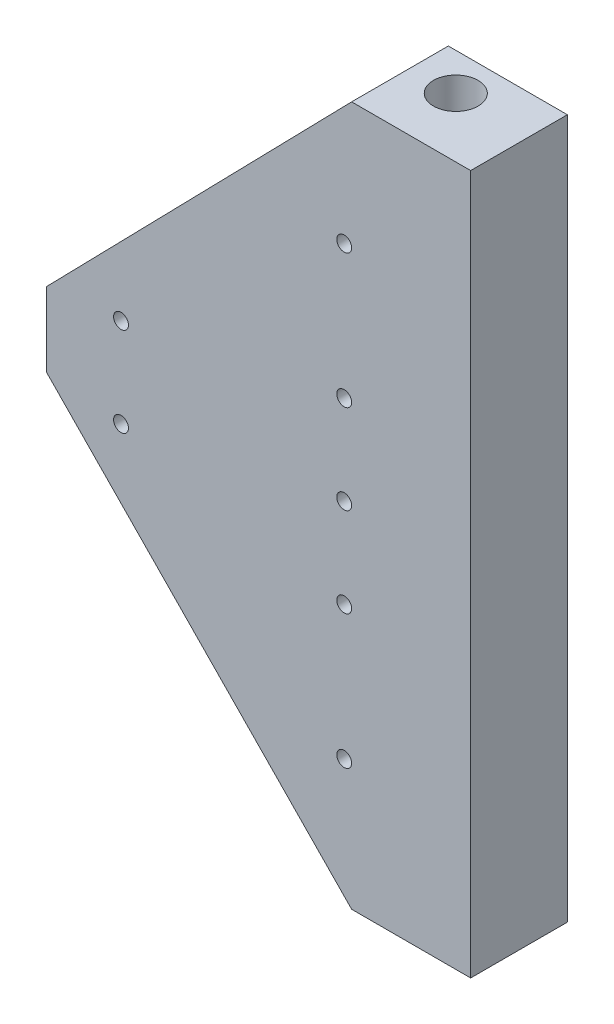
from build123d import *

# Parameters (mm, degrees)
SKETCH2_W               = 80
SKETCH2_H               = 25
BOSS_EXTRUDE1_DEPTH     = 65
BOSS_EXTRUDE1_2_DEPTH   = 65
SKETCH2_W_2             = 70
SKETCH2_H_2             = 10
BOSS_EXTRUDE1_3_DEPTH   = 65
BOSS_EXTRUDE1_4_DEPTH   = 65
SKETCH2_H_3             = 30
BOSS_EXTRUDE1_5_DEPTH   = 65
BOSS_EXTRUDE1_6_DEPTH   = 65
CUT_EXTRUDE1_DEPTH      = 313.209865315
CUT_EXTRUDE1_DEPTH_BACK = 313.209865315
SKETCH3_R               = 15
SKETCH3_R_2             = 6.25
BOSS_EXTRUDE5_DEPTH     = 10
CUT_EXTRUDE2_REACH      = 314.21
SKETCH7_R               = 5
SKETCH8_W               = 65
SKETCH8_H               = 470
BOSS_EXTRUDE6_DEPTH     = 3


with BuildPart() as part:
    # Sketch2 → Boss-Extrude1 (new body)
    with BuildSketch(Plane(origin=(0, 0, 0), x_dir=(1, 0, 0), z_dir=(0, 0, -1))):
        with Locations((155, -112.9)):
            Rectangle(SKETCH2_W, SKETCH2_H)
    extrude(amount=BOSS_EXTRUDE1_DEPTH)


with BuildPart() as body_2:
    # Sketch2 → Boss-Extrude1 2 (new body)
    with BuildSketch(Plane(origin=(0, 0, 0), x_dir=(1, 0, 0), z_dir=(0, 0, -1))):
        with Locations((155, 112.9)):
            Rectangle(SKETCH2_W, SKETCH2_H)
    extrude(amount=BOSS_EXTRUDE1_2_DEPTH)


with BuildPart() as body_3:
    # Sketch2 → Boss-Extrude1 3 (new body)
    with BuildSketch(Plane(origin=(0, 0, 0), x_dir=(1, 0, 0), z_dir=(0, 0, -1))):
        with Locations((-35, 15)):
            Rectangle(SKETCH2_W_2, SKETCH2_H_2)
    extrude(amount=BOSS_EXTRUDE1_3_DEPTH)


with BuildPart() as body_4:
    # Sketch2 → Boss-Extrude1 4 (new body)
    with BuildSketch(Plane(origin=(0, 0, 0), x_dir=(1, 0, 0), z_dir=(0, 0, -1))):
        with Locations((-35, -15)):
            Rectangle(SKETCH2_W_2, SKETCH2_H_2)
    extrude(amount=BOSS_EXTRUDE1_4_DEPTH)


with BuildPart() as body_5:
    # Sketch2 → Boss-Extrude1 5 (new body)
    with BuildSketch(Plane(origin=(0, 0, 0), x_dir=(1, 0, 0), z_dir=(0, 0, -1))):
        with Locations((155, 220)):
            Rectangle(SKETCH2_W, SKETCH2_H_3)
    extrude(amount=BOSS_EXTRUDE1_5_DEPTH)


with BuildPart() as body_6:
    # Sketch2 → Boss-Extrude1 6 (new body)
    with BuildSketch(Plane(origin=(0, 0, 0), x_dir=(1, 0, 0), z_dir=(0, 0, -1))):
        with Locations((155, -220)):
            Rectangle(SKETCH2_W, SKETCH2_H_3)
    extrude(amount=BOSS_EXTRUDE1_6_DEPTH)


with BuildPart() as cut_extrude1_tool:
    # Sketch3 → Cut-Extrude1 (new, two sides: drawn at the far end of the back side and taken through both)
    with BuildSketch(Plane.XZ.offset(-CUT_EXTRUDE1_DEPTH_BACK)):
        with Locations(Location((145, -40, 0), (0, 0, 270))):
            Circle(SKETCH3_R)
        with Locations(Location((-54, -25, 0), (0, 0, 270))):
            Circle(SKETCH3_R_2)
        with BuildLine():
            Line((0, 0), (-43.621584917, -37.17737658))
            ThreePointArc((-43.621584917, -37.17737658), (-60.706167261, -39.526779432), (-70, -25))
            Line((-70, -25), (-75, -25))
            Line((-75, -25), (-75, -70))
            Line((-75, -70), (5, -70))
            Line((5, -70), (5, 0))
            Line((5, 0), (0, 0))
        make_face()
    extrude(amount=CUT_EXTRUDE1_DEPTH + CUT_EXTRUDE1_DEPTH_BACK)


with BuildPart() as part_1:
    add(part.part)

    # Cut-Extrude1: cut by cut_extrude1_tool
    add(cut_extrude1_tool.part, mode=Mode.SUBTRACT)



with BuildPart() as body_2_1:
    add(body_2.part)

    # Cut-Extrude1: cut by cut_extrude1_tool
    add(cut_extrude1_tool.part, mode=Mode.SUBTRACT)


with BuildPart() as body_3_1:
    add(body_3.part)

    # Cut-Extrude1: cut by cut_extrude1_tool
    add(cut_extrude1_tool.part, mode=Mode.SUBTRACT)


with BuildPart() as body_4_1:
    add(body_4.part)

    # Cut-Extrude1: cut by cut_extrude1_tool
    add(cut_extrude1_tool.part, mode=Mode.SUBTRACT)


with BuildPart() as body_5_1:
    add(body_5.part)

    # Cut-Extrude1: cut by cut_extrude1_tool
    add(cut_extrude1_tool.part, mode=Mode.SUBTRACT)


with BuildPart() as body_6_1:
    add(body_6.part)

    # Cut-Extrude1: cut by cut_extrude1_tool
    add(cut_extrude1_tool.part, mode=Mode.SUBTRACT)


with BuildPart() as part_2:
    add(part_1.part)

    add(body_2_1.part)  # Boss-Extrude5 merges body 2

    add(body_3_1.part)  # Boss-Extrude5 merges body 3

    add(body_4_1.part)  # Boss-Extrude5 merges body 4

    add(body_5_1.part)  # Boss-Extrude5 merges body 5

    add(body_6_1.part)  # Boss-Extrude5 merges body 6
    # Sketch6 → Boss-Extrude5 (add)
    with BuildSketch(Plane.XY):
        Polygon((195, 235), (195, -235), (115, -235), (-90, -25), (-90, 25), (115, 235), align=None)
    extrude(amount=-BOSS_EXTRUDE5_DEPTH)

    # Sketch7 → Cut-Extrude2 (cut, up to next)
    with BuildSketch(Plane.XY, mode=Mode.PRIVATE) as cut_extrude2_sk1:
        with Locations((110, 150)):
            Circle(SKETCH7_R)
    cut_extrude2_tool1 = extrude(cut_extrude2_sk1.sketch, amount=-CUT_EXTRUDE2_REACH, mode=Mode.PRIVATE) & part_2.part
    # Sketch7 → Cut-Extrude2 (cut, up to next)
    with BuildSketch(Plane.XY, mode=Mode.PRIVATE) as cut_extrude2_sk2:
        with Locations((110, 60)):
            Circle(SKETCH7_R)
    cut_extrude2_tool2 = extrude(cut_extrude2_sk2.sketch, amount=-CUT_EXTRUDE2_REACH, mode=Mode.PRIVATE) & part_2.part
    # Sketch7 → Cut-Extrude2 (cut, up to next)
    with BuildSketch(Plane.XY, mode=Mode.PRIVATE) as cut_extrude2_sk3:
        with Locations((110, 0)):
            Circle(SKETCH7_R)
    cut_extrude2_tool3 = extrude(cut_extrude2_sk3.sketch, amount=-CUT_EXTRUDE2_REACH, mode=Mode.PRIVATE) & part_2.part
    # Sketch7 → Cut-Extrude2 (cut, up to next)
    with BuildSketch(Plane.XY, mode=Mode.PRIVATE) as cut_extrude2_sk4:
        with Locations((-40, 30)):
            Circle(SKETCH7_R)
    cut_extrude2_tool4 = extrude(cut_extrude2_sk4.sketch, amount=-CUT_EXTRUDE2_REACH, mode=Mode.PRIVATE) & part_2.part
    # Sketch7 → Cut-Extrude2 (cut, up to next)
    with BuildSketch(Plane.XY, mode=Mode.PRIVATE) as cut_extrude2_sk5:
        with Locations(Location((-40, -30, 0), (0, 0, 180))):
            Circle(SKETCH7_R)
    cut_extrude2_tool5 = extrude(cut_extrude2_sk5.sketch, amount=-CUT_EXTRUDE2_REACH, mode=Mode.PRIVATE) & part_2.part
    # Sketch7 → Cut-Extrude2 (cut, up to next)
    with BuildSketch(Plane.XY, mode=Mode.PRIVATE) as cut_extrude2_sk6:
        with Locations(Location((110, -60, 0), (0, 0, 180))):
            Circle(SKETCH7_R)
    cut_extrude2_tool6 = extrude(cut_extrude2_sk6.sketch, amount=-CUT_EXTRUDE2_REACH, mode=Mode.PRIVATE) & part_2.part
    # Sketch7 → Cut-Extrude2 (cut, up to next)
    with BuildSketch(Plane.XY, mode=Mode.PRIVATE) as cut_extrude2_sk7:
        with Locations(Location((110, -150, 0), (0, 0, 180))):
            Circle(SKETCH7_R)
    cut_extrude2_tool7 = extrude(cut_extrude2_sk7.sketch, amount=-CUT_EXTRUDE2_REACH, mode=Mode.PRIVATE) & part_2.part
    add(cut_extrude2_tool1.solids().sort_by_distance((110, 150, 0))[0], mode=Mode.SUBTRACT)
    add(cut_extrude2_tool2.solids().sort_by_distance((110, 60, 0))[0], mode=Mode.SUBTRACT)
    add(cut_extrude2_tool3.solids().sort_by_distance((110, 0, 0))[0], mode=Mode.SUBTRACT)
    add(cut_extrude2_tool4.solids().sort_by_distance((-40, 30, 0))[0], mode=Mode.SUBTRACT)
    add(cut_extrude2_tool5.solids().sort_by_distance((-40, -30, 0))[0], mode=Mode.SUBTRACT)
    add(cut_extrude2_tool6.solids().sort_by_distance((110, -60, 0))[0], mode=Mode.SUBTRACT)
    add(cut_extrude2_tool7.solids().sort_by_distance((110, -150, 0))[0], mode=Mode.SUBTRACT)

    # Sketch8 → Boss-Extrude6 (add)
    with BuildSketch(Plane(origin=(195, 0, 0), x_dir=(0, 0, -1), z_dir=(1, 0, 0))):
        with Locations((32.5, 0)):
            Rectangle(SKETCH8_W, SKETCH8_H)
    extrude(amount=-BOSS_EXTRUDE6_DEPTH)


solid = part_2.part
